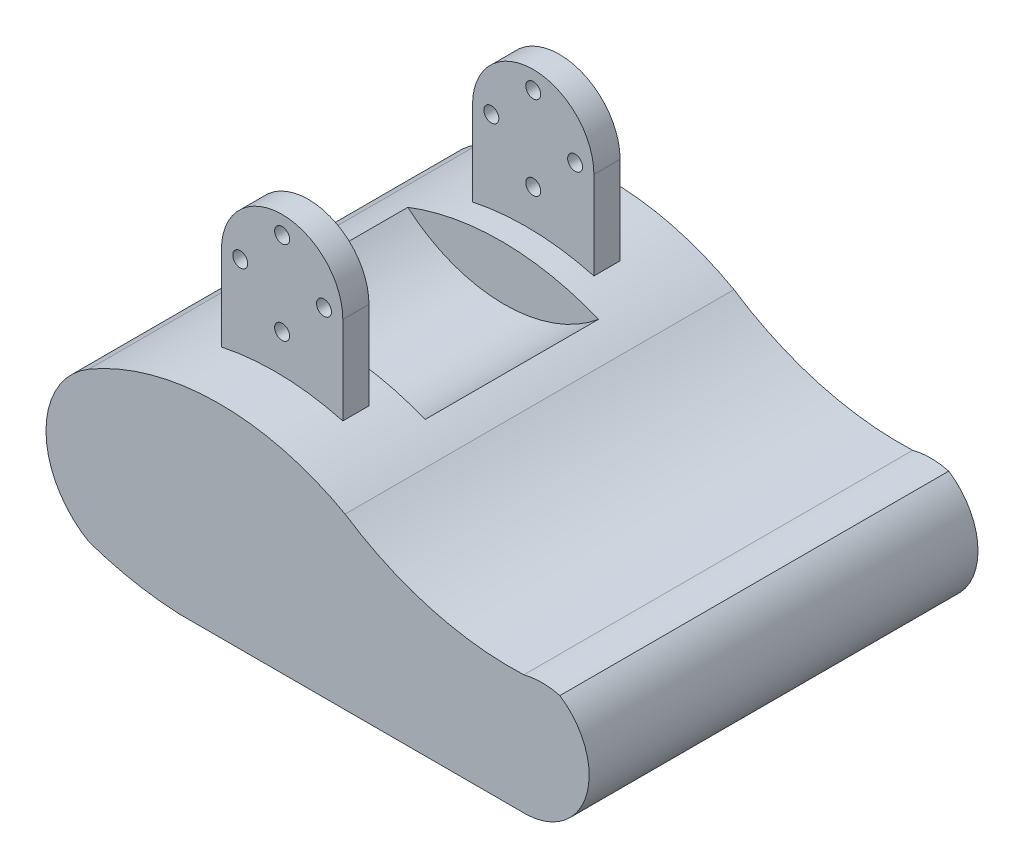
from build123d import *

# Parameters (mm, degrees)
BOSS_EXTRUDE1_DEPTH = 40
BOSS_EXTRUDE2_START = -1.2
BOSS_EXTRUDE2_DEPTH = 4.375
CUT_EXTRUDE2_START  = -29
CUT_EXTRUDE2_DEPTH  = 29
SKETCH10_R          = 1.25
CUT_EXTRUDE4_DEPTH  = 10
BOSS_EXTRUDE3_DEPTH = 12.5
SKETCH5_W           = 51.025429481
SKETCH5_H           = 59
CUT_EXTRUDE3_DEPTH  = 3.175


with BuildPart() as part:
    # Sketch1 → Boss-Extrude1 (new body)
    with BuildSketch(Plane.XY):
        with BuildLine():
            Line((-15, -2.886329782), (42.025429481, -2.886329782))
            ThreePointArc((42.025429481, -2.886329782), (53.05879951, 4.537892473), (48.73397068, 17.113670218))
            ThreePointArc((48.73397068, 17.113670218), (45.721020148, 17.497008544), (42.708069616, 17.113670218))
            ThreePointArc((42.708069616, 17.113670218), (27.113259503, 18.919115101), (12.833158081, 25.441111501))
            ThreePointArc((12.833158081, 25.441111501), (-8.642012727, 30.909979938), (-30, 25))
            ThreePointArc((-30, 25), (-37.166841919, 12.5), (-30, 0))
            ThreePointArc((-30, 0), (-22.60067635, -1.966370959), (-15, -2.886329782))
        make_face()
    extrude(amount=BOSS_EXTRUDE1_DEPTH)

    # Sketch3 → Boss-Extrude2 (add)
    with BuildSketch(Plane.XY.offset(40).offset(BOSS_EXTRUDE2_START)):
        with BuildLine():
            Line((-17.166841919, 44.092125176), (-17.166841919, 16.592125176))
            Line((-17.166841919, 16.592125176), (3.120389758, 16.592125176))
            Line((3.120389758, 16.592125176), (3.120389758, 44.092125176))
            ThreePointArc((3.120389758, 44.092125176), (-7.02322608, 54.235741015), (-17.166841919, 44.092125176))
        make_face()
    boss_extrude2 = extrude(amount=BOSS_EXTRUDE2_DEPTH)

    # Sketch4 → Cut-Extrude2 (cut)
    with BuildSketch(Plane.XY.offset(34.4).offset(CUT_EXTRUDE2_START)):
        with BuildLine():
            ThreePointArc((-23.782802313, 27.999798652), (-7.894532573, 21.994601327), (8.097551753, 27.717603087))
            ThreePointArc((8.097551753, 27.717603087), (-7.81561096, 30.910577643), (-23.782802313, 27.999798652))
        make_face()
    extrude(amount=CUT_EXTRUDE2_DEPTH, mode=Mode.SUBTRACT)

    # Sketch10 → Cut-Extrude4 (cut)
    with BuildSketch(Plane.XY.offset(43.175)):
        with Locations((-7.02322608, 51.235741015)):
            Circle(SKETCH10_R)
        with Locations((-0.02322608, 44.235741015)):
            Circle(SKETCH10_R)
        with Locations((-7.02322608, 37.235741015)):
            Circle(SKETCH10_R)
        with Locations((-14.02322608, 44.235741015)):
            Circle(SKETCH10_R)
    cut_extrude4 = extrude(amount=-CUT_EXTRUDE4_DEPTH, mode=Mode.SUBTRACT)

    # Sketch6 → Boss-Extrude3 (add)
    with BuildSketch(Plane.XY.offset(40)):
        with BuildLine():
            ThreePointArc((12.833158081, 25.441111501), (8.097551753, 27.717603087), (3.120389758, 29.401717013))
            Line((3.120389758, 29.401717013), (3.120389758, 16.592125176))
            Line((3.120389758, 16.592125176), (-17.166841919, 16.592125176))
            Line((-17.166841919, 16.592125176), (-17.166841919, 29.969927353))
            ThreePointArc((-17.166841919, 29.969927353), (-23.782802313, 27.999798652), (-30, 25))
            ThreePointArc((-30, 25), (-37.166841919, 12.5), (-30, 0))
            ThreePointArc((-30, 0), (-22.60067635, -1.966370959), (-15, -2.886329782))
            Line((-15, -2.886329782), (42.025429481, -2.886329782))
            ThreePointArc((42.025429481, -2.886329782), (53.05879951, 4.537892473), (48.73397068, 17.113670218))
            ThreePointArc((48.73397068, 17.113670218), (45.721020148, 17.497008544), (42.708069616, 17.113670218))
            ThreePointArc((42.708069616, 17.113670218), (27.113259503, 18.919115101), (12.833158081, 25.441111501))
        make_face()
        with BuildLine():
            Line((3.120389758, 16.592125176), (3.120389758, 29.401717013))
            ThreePointArc((3.120389758, 29.401717013), (-6.989349265, 30.895351044), (-17.166841919, 29.969927353))
            Line((-17.166841919, 29.969927353), (-17.166841919, 16.592125176))
            Line((-17.166841919, 16.592125176), (3.120389758, 16.592125176))
        make_face()
    boss_extrude3 = extrude(amount=BOSS_EXTRUDE3_DEPTH)

    # Mirror4: Boss-Extrude3 across plane
    add(boss_extrude3.mirror(Plane(origin=(0, 0, 20), x_dir=(1, 0, 0), z_dir=(0, 0, -1))))

    # Sketch5 → Cut-Extrude3 (cut)
    with BuildSketch(Plane.XZ.offset(2.886329782)):
        with Locations((13.512714741, 20)):
            Rectangle(SKETCH5_W, SKETCH5_H)
    extrude(amount=-CUT_EXTRUDE3_DEPTH, mode=Mode.SUBTRACT)

    # Mirror5: Boss-Extrude2, Cut-Extrude4 across plane
    add(boss_extrude2.mirror(Plane(origin=(0, 0, 20), x_dir=(1, 0, 0), z_dir=(0, 0, -1))))
    add(cut_extrude4.mirror(Plane(origin=(0, 0, 20), x_dir=(1, 0, 0), z_dir=(0, 0, -1))), mode=Mode.SUBTRACT)


solid = part.part
